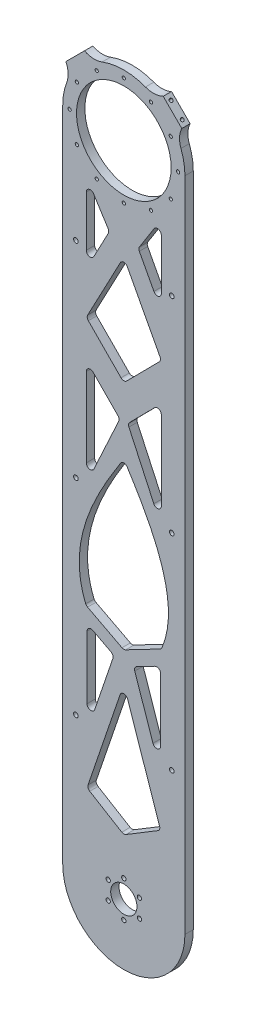
from build123d import *

# Parameters (mm, degrees)
SKETCH2_R                            = 10
SKETCH2_R_2                          = 1.65
BOSS_EXTRUDE1_DEPTH                  = 6.35
CUT_EXTRUDE1_DEPTH                   = 10
FILLET3_R                            = 3
SKETCH5_R                            = 1.75
CUT_EXTRUDE2_DEPTH                   = 549.511460792
SKETCH6_R                            = 26.5
CUT_EXTRUDE3_DEPTH                   = 10
BOSS_EXTRUDE2_START                  = -6.35
BOSS_EXTRUDE2_DEPTH                  = 6.35
TAP_DRILL_FOR_M3X0_5_TAP1_AT_2_COUNT = 2
TAP_DRILL_FOR_M3X0_5_TAP1_AT_2_PITCH = 12
CIRPATTERN2_COUNT                    = 2
CIRPATTERN2_ANGLE                    = 90
SKETCH11_R                           = 36
CUT_EXTRUDE5_DEPTH                   = 549.511460792
SKETCH12_R                           = 1.25
CUT_EXTRUDE6_DEPTH                   = 549.511460792
CIRPATTERN3_COUNT                    = 12


with BuildPart() as part:
    # Sketch2 → Boss-Extrude1 (new body)
    with BuildSketch(Plane.XY):
        with BuildLine():
            Line((-46.5, 0), (-46.5, 500))
            ThreePointArc((-46.5, 500), (0, 546.5), (46.5, 500))
            Line((46.5, 500), (46.5, 0))
            ThreePointArc((46.5, 0), (0, -46.5), (-46.5, 0))
        make_face()
        Circle(SKETCH2_R, mode=Mode.SUBTRACT)
        with Locations((0, 13.75)):
            Circle(SKETCH2_R_2, mode=Mode.SUBTRACT)
        with Locations((11.907849302, 6.875)):
            Circle(SKETCH2_R_2, mode=Mode.SUBTRACT)
        with Locations((11.907849302, -6.875)):
            Circle(SKETCH2_R_2, mode=Mode.SUBTRACT)
        with Locations((0, -13.75)):
            Circle(SKETCH2_R_2, mode=Mode.SUBTRACT)
        with Locations((-11.907849302, -6.875)):
            Circle(SKETCH2_R_2, mode=Mode.SUBTRACT)
        with Locations((-11.907849302, 6.875)):
            Circle(SKETCH2_R_2, mode=Mode.SUBTRACT)
    extrude(amount=BOSS_EXTRUDE1_DEPTH)

    # Sketch4 → Cut-Extrude1 (cut)
    with BuildSketch(Plane.XY.offset(6.35)):
        Polygon((28.005258112, 59.37595418), (0, 42.411661153), (-28.005258112, 59.37595418), (0, 141.693437584), align=None)
        Polygon((-7.5, 156.905935087), (-28.005258112, 96.633637735), (-28.005258112, 167.582877854), align=None)
        Polygon((28.005258112, 167.582877854), (7.5, 156.905935087), (28.005258112, 96.633637735), align=None)
        with BuildLine():
            Line((0, 164.275138905), (28.550546746, 179.141206521))
            add(Edge.make_bspline(
                [(28.550546746, 179.141206521), (45.32025339, 216.985654627), (19.430092874, 259.790255689), (0, 290.025756679)],
                knots=[0, 0, 0, 0, 1, 1, 1, 1], degree=3))
            add(Edge.make_bspline(
                [(-28.550546746, 179.141206521), (-45.32025339, 216.985654627), (-19.430092874, 259.790255689), (0, 290.025756679)],
                knots=[0, 0, 0, 0, 1, 1, 1, 1], degree=3))
            Line((-28.550546746, 179.141206521), (0, 164.275138905))
        make_face()
        Polygon((28.550546746, 259.58677623), (3, 314.938284003), (28.550546746, 340.793051053), align=None)
        Polygon((-3, 314.938284003), (-28.550546746, 340.793051053), (-28.550546746, 259.58677623), align=None)
        Polygon((0, 423.142843498), (-28.550546746, 369.246205395), (0, 340.355718526), (28.550546746, 369.246205395), align=None)
        Polygon((-28.550546746, 462.095190817), (-28.550546746, 401.290241252), (-11, 434.421497018), align=None)
        Polygon((28.550546746, 401.290241252), (11, 434.421497018), (28.550546746, 462.095190817), align=None)
    extrude(amount=-CUT_EXTRUDE1_DEPTH, mode=Mode.SUBTRACT)

    # Fillet3
    fillet3_edges = [part.edges().sort_by_distance(p)[0] for p in [
        (-11, 434.421497018, 3.175),
        (-28.550546746, 401.290241252, 3.175),
        (28.550546746, 401.290241252, 3.175),
        (11, 434.421497018, 3.175),
        (28.550546746, 462.095190817, 3.175),
        (-28.550546746, 462.095190817, 3.175),
        (0, 423.142843498, 3.175),
        (-28.550546746, 369.246205395, 3.175),
        (28.550546746, 369.246205395, 3.175),
        (0, 340.355718526, 3.175),
        (28.550546746, 340.793051053, 3.175),
        (-28.550546746, 340.793051053, 3.175),
        (-3, 314.938284003, 3.175),
        (3, 314.938284003, 3.175),
        (28.550546746, 259.58677623, 3.175),
        (-28.550546746, 259.58677623, 3.175),
        (28.550546746, 179.141206521, 3.175),
        (0, 290.025756679, 3.175),
        (-28.550546746, 179.141206521, 3.175),
        (0, 164.275138905, 3.175),
        (-28.005258112, 96.633637735, 3.175),
        (28.005258112, 96.633637735, 3.175),
        (7.5, 156.905935087, 3.175),
        (-28.005258112, 167.582877854, 3.175),
        (28.005258112, 167.582877854, 3.175),
        (0, 141.693437584, 3.175),
        (28.005258112, 59.37595418, 3.175),
        (-28.005258112, 59.37595418, 3.175),
        (0, 42.411661153, 3.175),
        (-7.5, 156.905935087, 3.175),
    ]]
    fillet(fillet3_edges, radius=FILLET3_R)

    # Sketch5 → Cut-Extrude2 (cut, through all)
    with BuildSketch(Plane.XY.offset(6.35)):
        with Locations((36.5, 103.175)):
            Circle(SKETCH5_R)
        with Locations(Location((-36.5, 103.175, 0), (0, 0, 180))):
            Circle(SKETCH5_R)
        with Locations(Location((36.5, 259.525, 0), (0, 0, 180))):
            Circle(SKETCH5_R)
        with Locations((-36.5, 259.525)):
            Circle(SKETCH5_R)
        with Locations((36.5, 415.875)):
            Circle(SKETCH5_R)
        with Locations(Location((-36.5, 415.875, 0), (0, 0, 180))):
            Circle(SKETCH5_R)
    extrude(amount=-CUT_EXTRUDE2_DEPTH, mode=Mode.SUBTRACT)

    # Sketch6 → Cut-Extrude3 (cut)
    with BuildSketch(Plane.XY.offset(6.35)):
        with Locations((0, 500)):
            Circle(SKETCH6_R)
    extrude(amount=-CUT_EXTRUDE3_DEPTH, mode=Mode.SUBTRACT)

    # Sketch7 → Boss-Extrude2 (add)
    with BuildSketch(Plane.XY.offset(6.35).offset(BOSS_EXTRUDE2_START)):
        with BuildLine():
            Line((44.110383395, 529.968247771), (29.968247771, 544.110383395))
            ThreePointArc((29.968247771, 544.110383395), (23.286397782, 542.399293624), (16.474718596, 543.483717035))
            ThreePointArc((16.474718596, 543.483717035), (32.880465325, 532.880465325), (43.483717035, 516.474718596))
            ThreePointArc((43.483717035, 516.474718596), (42.399293624, 523.286397782), (44.110383395, 529.968247771))
        make_face()
    boss_extrude2 = extrude(amount=BOSS_EXTRUDE2_DEPTH)

    # Sketch9 → Tap Drill for M3x0.5 Tap1 (revolve, cut)
    with BuildSketch(Plane(origin=(32.796674896, 541.28195627, 3.175), x_dir=(-0.7071067811865481, 0.7071067811865469, 0), z_dir=(0, 0, 1))):
        Polygon((0, 0), (0, 5.751075774), (1.25, 5), (1.25, 0), align=None)
    tap_drill_for_m3x0_5_tap1 = revolve(axis=Axis((37.286802956, 545.772084331, 3.175), (-0.7071067811865468, -0.7071067811865482, 0)), mode=Mode.SUBTRACT)

    # Tap Drill for M3x0.5 Tap1 at 2: Tap Drill for M3x0.5 Tap1 ×2
    with Locations(*[Vector(0.7071067811865482, -0.7071067811865468, 0) * (i * TAP_DRILL_FOR_M3X0_5_TAP1_AT_2_PITCH) for i in range(1, TAP_DRILL_FOR_M3X0_5_TAP1_AT_2_COUNT)]):
        add(tap_drill_for_m3x0_5_tap1, mode=Mode.SUBTRACT)

    # CirPattern2: Boss-Extrude2, Tap Drill for M3x0.5 Tap1 ×2 about axis
    cirpattern2_axis = Axis((0, 500, 0), (0, 0, 1))
    add([boss_extrude2.rotate(cirpattern2_axis, i * CIRPATTERN2_ANGLE / (CIRPATTERN2_COUNT - 1)) for i in range(1, CIRPATTERN2_COUNT)])
    add([tap_drill_for_m3x0_5_tap1.rotate(cirpattern2_axis, i * CIRPATTERN2_ANGLE / (CIRPATTERN2_COUNT - 1)) for i in range(1, CIRPATTERN2_COUNT)], mode=Mode.SUBTRACT)

    # CirPattern2 copy 1 sketch → CirPattern2 copy 1 (revolve, cut)
    with BuildSketch(Plane(origin=(-32.796674896, 541.28195627, 3.175), x_dir=(-0.7071067811865445, -0.7071067811865506, 0), z_dir=(0, 0, 1))):
        Polygon((0, 0), (0, 5.751075774), (1.25, 5), (1.25, 0), align=None)
    revolve(axis=Axis((-37.286802956, 545.772084331, 3.175), (0.7071067811865507, -0.7071067811865444, 0)), mode=Mode.SUBTRACT)

    # Sketch11 → Cut-Extrude5 (cut, through all)
    with BuildSketch(Plane.XY.offset(6.35)):
        with Locations((0, 500)):
            Circle(SKETCH11_R)
    extrude(amount=-CUT_EXTRUDE5_DEPTH, mode=Mode.SUBTRACT)

    # Sketch12 → Cut-Extrude6 (cut, symmetric)
    with BuildSketch(Plane.XY.offset(6.35)):
        with Locations((0, 541.25)):
            Circle(SKETCH12_R)
    cut_extrude6 = extrude(amount=CUT_EXTRUDE6_DEPTH, both=True, mode=Mode.SUBTRACT)

    # CirPattern3: Cut-Extrude6 ×12 about axis
    cirpattern3_axis = Axis((0, 500, 0), (0, 0, 1))
    for i in range(1, CIRPATTERN3_COUNT):
        add(cut_extrude6.rotate(cirpattern3_axis, i * 360 / CIRPATTERN3_COUNT), mode=Mode.SUBTRACT)


solid = part.part
